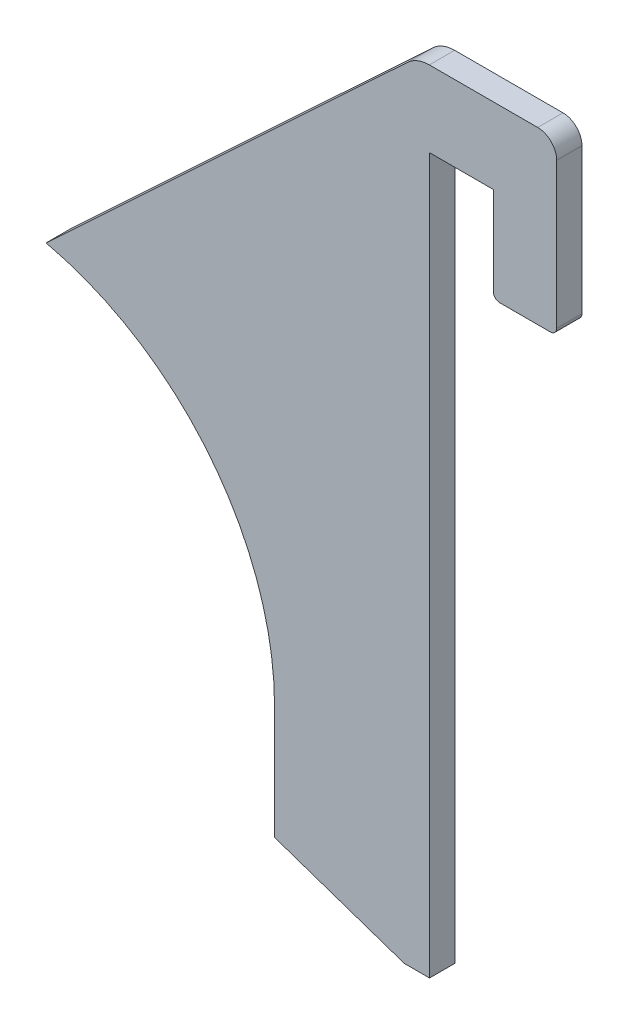
from build123d import *
from OCP.BRepFilletAPI import BRepFilletAPI_MakeFillet

# Parameters (mm, degrees)
BOSS_EXTRU_1_DEPTH = 4
FILLET1_R1         = 5
FILLET1_R2         = 3
FILLET1_R3         = 1


with BuildPart() as part:
    # Esquisse1 → Boss.-Extru.1 (new body)
    with BuildSketch(Plane.XY):
        with BuildLine():
            Line((46.5, 0), (46.5, -18))
            Line((46.5, -18), (67, -25))
            Line((67, -25), (71, -25))
            Line((71, -25), (71, 88))
            Line((71, 88), (81.1, 88))
            Line((81.1, 88), (81.1, 73))
            Line((81.1, 73), (91.1, 73))
            Line((91.1, 73), (91.1, 100))
            Line((91.1, 100), (69, 100))
            Line((69, 100), (10.371982926, 45.328489608))
            ThreePointArc((10.371982926, 45.328489608), (36.363080219, 28.982346298), (46.5, 0))
        make_face()
    extrude(amount=BOSS_EXTRU_1_DEPTH)

    # Fillet1: one fillet with a radius per group of edges: ONE call of the kernel's fillet builder (fillet() takes one radius for all edges)
    fillet1_edges_1 = [part.edges().sort_by_distance(p)[0] for p in [
        (69, 100, 2),
    ]]
    fillet1_edges_2 = [part.edges().sort_by_distance(p)[0] for p in [
        (91.1, 100, 2),
    ]]
    fillet1_edges_3 = [part.edges().sort_by_distance(p)[0] for p in [
        (91.1, 73, 2),
        (81.1, 73, 2),
    ]]
    fillet1 = BRepFilletAPI_MakeFillet(part.part.solid().wrapped)
    for e in fillet1_edges_1:
        fillet1.Add(FILLET1_R1, e.wrapped)
    for e in fillet1_edges_2:
        fillet1.Add(FILLET1_R2, e.wrapped)
    for e in fillet1_edges_3:
        fillet1.Add(FILLET1_R3, e.wrapped)
    add(Compound.cast(fillet1.Shape()), mode=Mode.REPLACE)


solid = part.part
